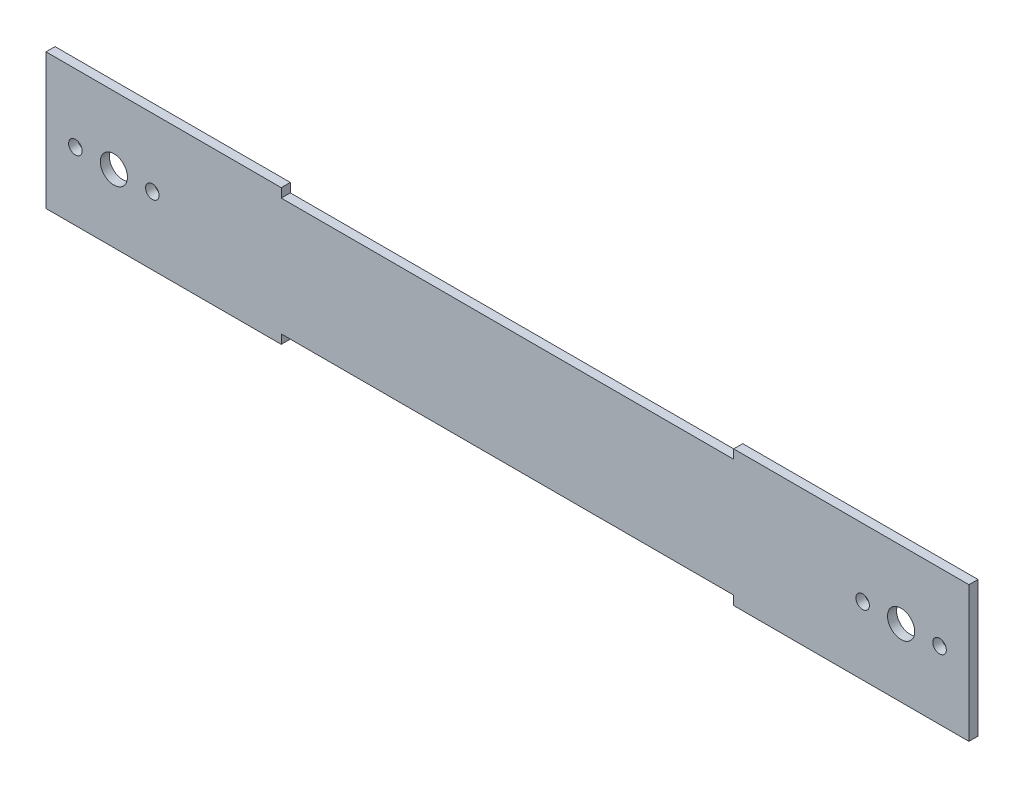
from build123d import *

# Parameters (mm, degrees)
BOSS_EXTRUDE1_DEPTH = 2
SKETCH2_R           = 1.5
SKETCH2_R_2         = 3
CUT_EXTRUDE1_DEPTH  = 2


with BuildPart() as part:
    # Sketch1 → Boss-Extrude1 (new body)
    with BuildSketch(Plane.XY):
        Polygon((0, -15), (0, 0), (204, 0), (204, -15), (152, -15), (152, -13), (52, -13), (52, -15), align=None)
    boss_extrude1 = extrude(amount=BOSS_EXTRUDE1_DEPTH)

    # Mirror2: Boss-Extrude1 across plane
    add(boss_extrude1.mirror(Plane(origin=(0, 0, 2), x_dir=(0, 0, 1), z_dir=(0, -1, 0))))

    # Sketch2 → Cut-Extrude1 (cut)
    with BuildSketch(Plane.XY.offset(2)):
        with Locations((6.5, 0)):
            Circle(SKETCH2_R)
        with Locations((15, 0)):
            Circle(SKETCH2_R_2)
        with Locations((23.5, 0)):
            Circle(SKETCH2_R)
        with Locations((180.5, 0)):
            Circle(SKETCH2_R)
        with Locations((189, 0)):
            Circle(SKETCH2_R_2)
        with Locations((197.5, 0)):
            Circle(SKETCH2_R)
    extrude(amount=-CUT_EXTRUDE1_DEPTH, mode=Mode.SUBTRACT)


solid = part.part
